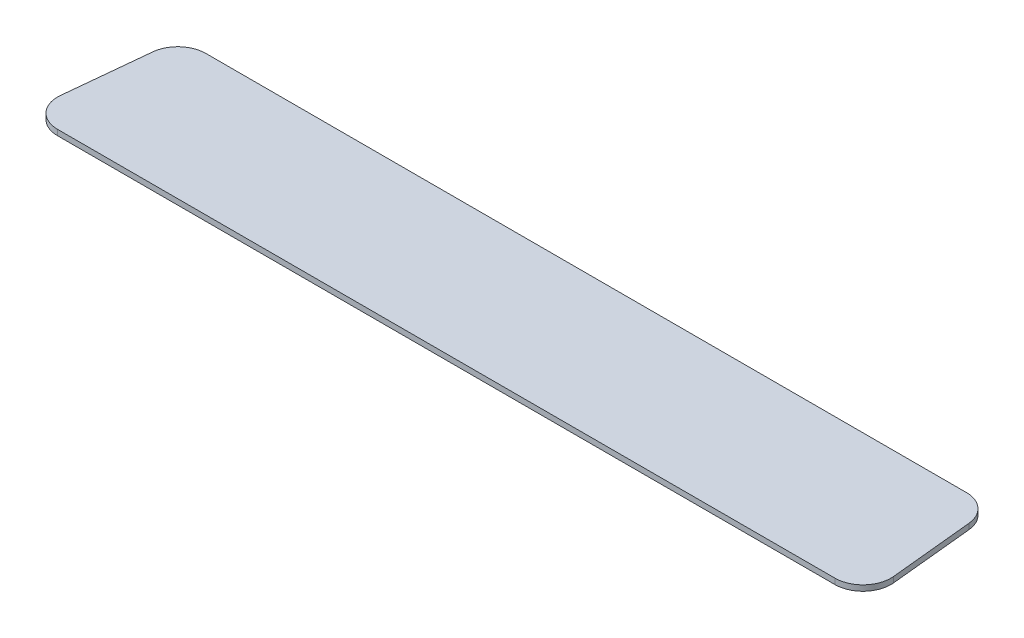
from build123d import *

# Parameters (mm, degrees)
BOSS_EXTRUDE1_DEPTH = 2


with BuildPart() as part:
    # Sketch3 → Boss-Extrude1 (new body)
    with BuildSketch(Plane(origin=(0, 0, 0), x_dir=(1, 0, 0), z_dir=(0, 1, 0))):
        with BuildLine():
            Line((-138.950124379, 0), (138.950124379, 0))
            ThreePointArc((138.950124379, 0), (146.364649714, 3.289946792), (148.900496281, 10.99503719))
            Line((148.900496281, 10.99503719), (145.900496281, 40.99503719))
            ThreePointArc((145.900496281, 40.99503719), (142.660177586, 47.414525336), (135.950124379, 50))
            Line((135.950124379, 50), (-135.950124379, 50))
            ThreePointArc((-135.950124379, 50), (-142.660177586, 47.414525336), (-145.900496281, 40.99503719))
            Line((-145.900496281, 40.99503719), (-148.900496281, 10.99503719))
            ThreePointArc((-148.900496281, 10.99503719), (-146.364649714, 3.289946792), (-138.950124379, 0))
        make_face()
    extrude(amount=BOSS_EXTRUDE1_DEPTH)


solid = part.part
